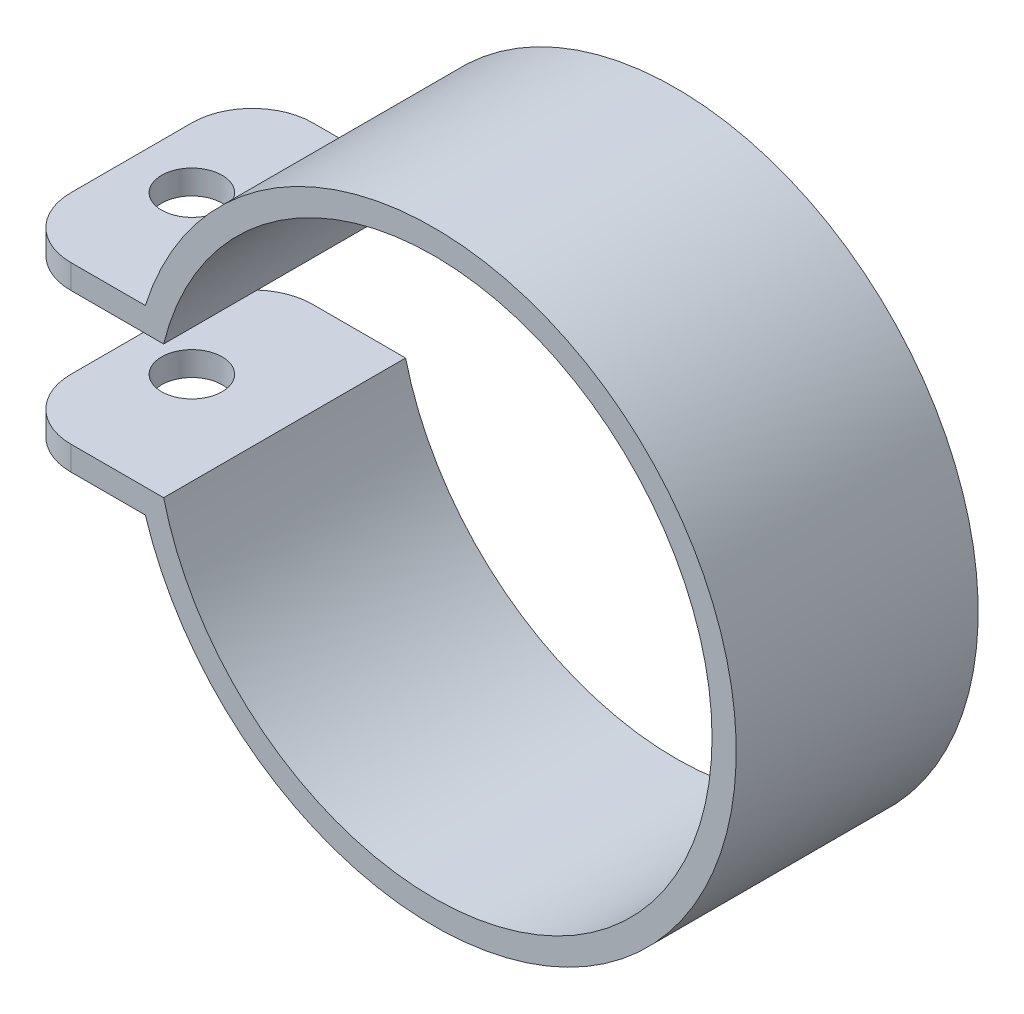
from build123d import *

# Parameters (mm, degrees)
BOSS_EXTRUDE1_DEPTH = 20
FILLET1_R           = 10
SKETCH2_R           = 5
CUT_EXTRUDE1_DEPTH  = 40


with BuildPart() as part:
    # Sketch1 → Boss-Extrude1 (new, symmetric)
    with BuildSketch(Plane.XY):
        with BuildLine():
            Line((-70, 15), (-47.696960071, 15))
            ThreePointArc((-47.696960071, 15), (50, 0), (-47.696960071, -15))
            Line((-47.696960071, -15), (-70, -15))
            Line((-70, -15), (-70, -11))
            Line((-70, -11), (-44.665422868, -11))
            ThreePointArc((-44.665422868, -11), (46, 0), (-44.665422868, 11))
            Line((-44.665422868, 11), (-70, 11))
            Line((-70, 11), (-70, 15))
        make_face()
    extrude(amount=BOSS_EXTRUDE1_DEPTH, both=True)

    # Fillet1
    fillet1_edges = [part.edges().sort_by_distance(p)[0] for p in [
        (-70, -13, -20),
        (-70, 13, 20),
        (-70, -13, 20),
        (-70, 13, -20),
    ]]
    fillet(fillet1_edges, radius=FILLET1_R)

    # Sketch2 → Cut-Extrude1 (cut)
    with BuildSketch(Plane(origin=(0, 15, 0), x_dir=(1, 0, 0), z_dir=(0, 1, 0))):
        with Locations(Location((-60, 0, 0), (0, 0, 270))):
            Circle(SKETCH2_R)
    extrude(amount=-CUT_EXTRUDE1_DEPTH, mode=Mode.SUBTRACT)


solid = part.part
